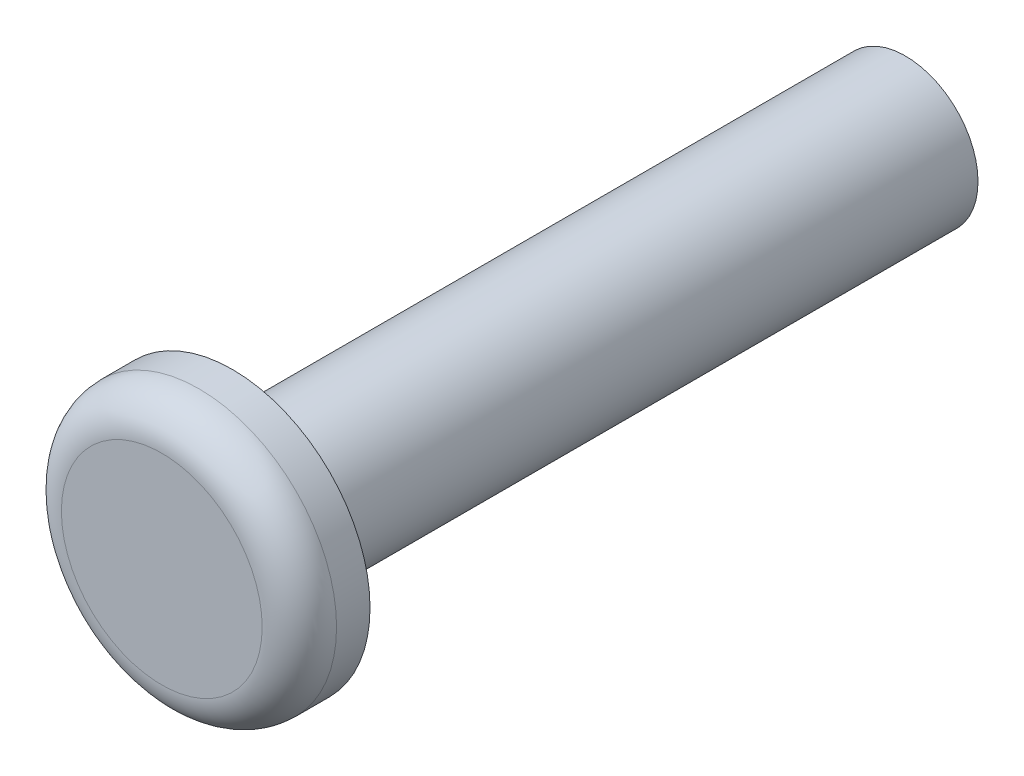
from build123d import *

# Parameters (mm, degrees)
FILLET1_R = 1


with BuildPart() as part:
    # Sketch1 → Revolve1 (revolve)
    with BuildSketch(Plane(origin=(0, 0, 0), x_dir=(0, 0, -1), z_dir=(1, 0, 0)), mode=Mode.PRIVATE) as revolve1_sk:
        Polygon((1.9, 1.95), (1.9, 3.7), (0, 3.7), (0, 0), (20, 0), (20, 1.95), align=None)
    revolve(revolve1_sk.sketch.rotate(Axis((0, 0, 0), (0, 0, -1)), 90), axis=Axis((0, 0, 0), (0, 0, -1)))

    # Fillet1
    fillet1_edges = [part.edges().sort_by_distance(p)[0] for p in [
        (-3.7, 0, 0),
    ]]
    fillet(fillet1_edges, radius=FILLET1_R)


solid = part.part
